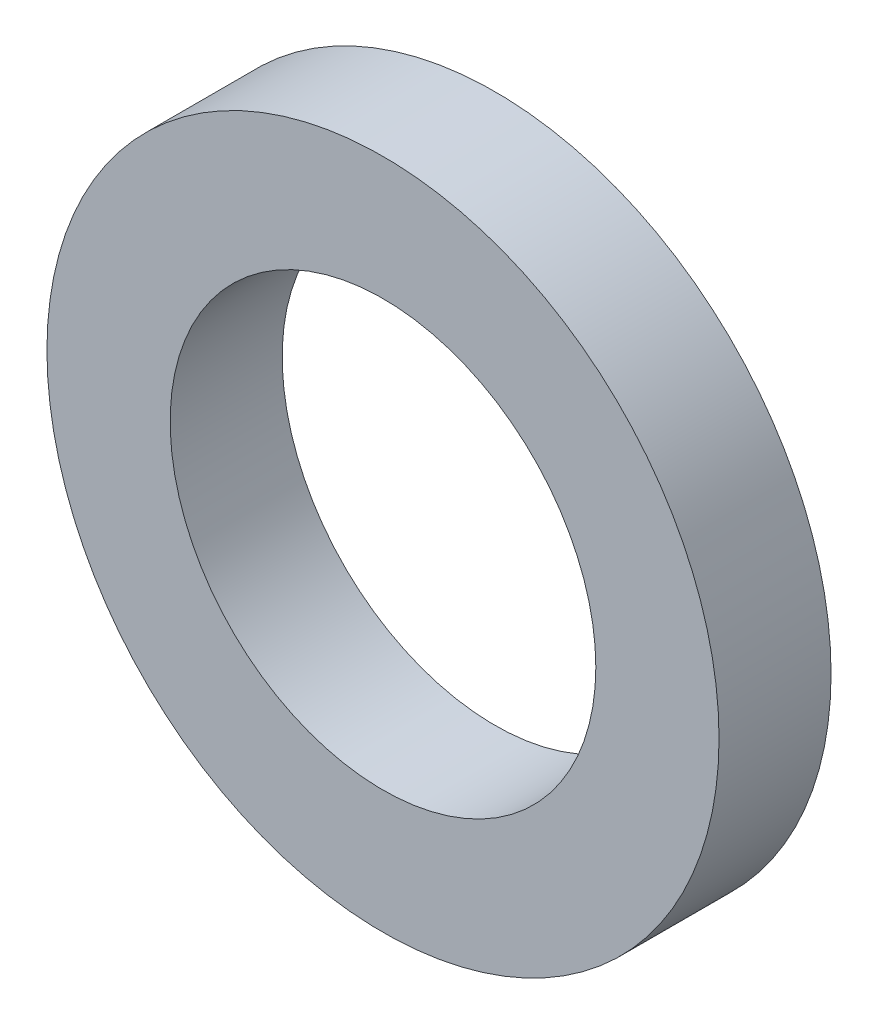
from build123d import *

# Parameters (mm, degrees)
SKETCH1_R           = 3
SKETCH1_R_2         = 1.9
BOSS_EXTRUDE1_DEPTH = 1
SCALE1_SCALE        = 1.5


with BuildPart() as part:
    # Sketch1 → Boss-Extrude1 (new body)
    with BuildSketch(Plane.XY):
        Circle(SKETCH1_R)
        Circle(SKETCH1_R_2, mode=Mode.SUBTRACT)
    extrude(amount=BOSS_EXTRUDE1_DEPTH)


with BuildPart() as part_1:
    # Scale1: scaled about (0, 0, 0.5)
    add(part.part.scale(SCALE1_SCALE).moved(Location((0, 0, -0.25))))


solid = part_1.part
